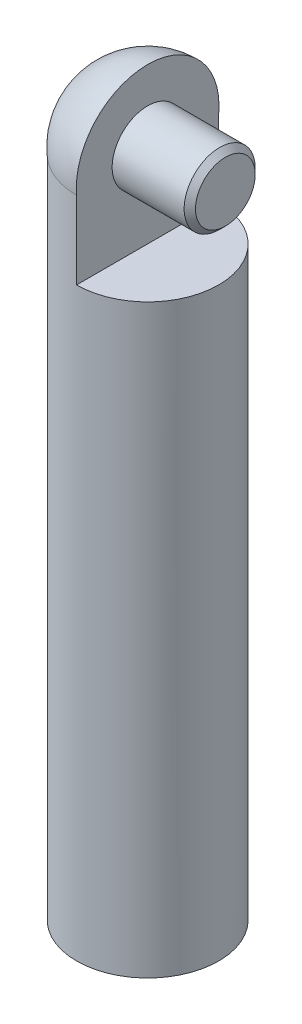
from build123d import *

# Parameters (mm, degrees)
SKETCH1_R               = 19.05
BOSS_EXTRUDE1_DEPTH     = 177.8
DOME1_FACE_RADIUS       = 19.05
DOME1_HEIGHT            = 20.828
CUT_EXTRUDE1_DEPTH      = 201.461172648
CUT_EXTRUDE1_DEPTH_BACK = 201.461172648
SKETCH2_W               = 31.75
SKETCH2_H               = 41.656
SKETCH3_R               = 9.525
BOSS_EXTRUDE2_DEPTH     = 20.828
CHAMFER1_SIZE           = 1.524


with BuildPart() as part:
    # Sketch1 → Boss-Extrude1 (new body)
    with BuildSketch(Plane(origin=(0, 0, 0), x_dir=(1, 0, 0), z_dir=(0, 1, 0))):
        with Locations(Location((0, 0, 0), (0, 0, 270))):
            Circle(SKETCH1_R)
    extrude(amount=BOSS_EXTRUDE1_DEPTH)

    # Dome1: a dome of height H over a round flat face of radius A is a cap of a sphere of radius (A * A + H * H) / (2 * H)
    dome1_r = (DOME1_FACE_RADIUS * DOME1_FACE_RADIUS + DOME1_HEIGHT * DOME1_HEIGHT) / (2 * DOME1_HEIGHT)
    dome1_base = Plane((0, 177.8, 0), z_dir=(0, 1, 0))
    with Locations(dome1_base.offset(DOME1_HEIGHT - dome1_r)):
        dome1_ball = Sphere(dome1_r, mode=Mode.PRIVATE)
    add(split(dome1_ball, bisect_by=dome1_base, keep=Keep.TOP, mode=Mode.PRIVATE))

    # Sketch2 → Cut-Extrude1 (cut, two sides: drawn at the far end of the back side and taken through both)
    with BuildSketch(Plane.XY.offset(-CUT_EXTRUDE1_DEPTH_BACK)):
        with Locations((15.875, 177.8)):
            Rectangle(SKETCH2_W, SKETCH2_H)
    extrude(amount=CUT_EXTRUDE1_DEPTH + CUT_EXTRUDE1_DEPTH_BACK, mode=Mode.SUBTRACT)

    # Sketch3 → Boss-Extrude2 (add)
    with BuildSketch(Plane(origin=(0, 0, 0), x_dir=(0, 0, -1), z_dir=(1, 0, 0))):
        with Locations(Location((0, 179.502109756, 0), (0, 0, 270))):
            Circle(SKETCH3_R)
    extrude(amount=BOSS_EXTRUDE2_DEPTH)

    # Chamfer1
    chamfer1_edges = [part.edges().sort_by_distance(p)[0] for p in [
        (20.828, 189.027109756, 0),
    ]]
    chamfer(chamfer1_edges, length=CHAMFER1_SIZE)


solid = part.part
